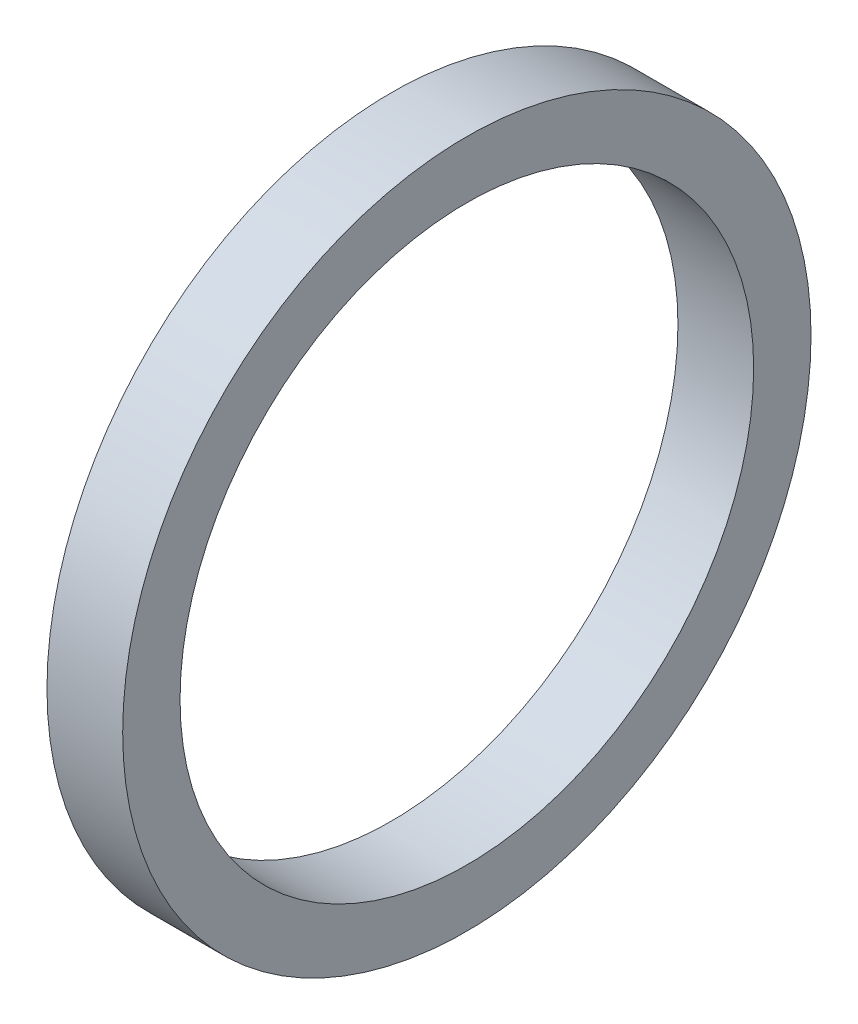
from build123d import *

# Parameters (mm, degrees)
SKETCH1_R           = 9.525
SKETCH1_R_2         = 7.9375
BOSS_EXTRUDE1_DEPTH = 2.0955


with BuildPart() as part:
    # Sketch1 → Boss-Extrude1 (new body)
    with BuildSketch(Plane(origin=(0, 0, 0), x_dir=(0, 0, -1), z_dir=(1, 0, 0))):
        Circle(SKETCH1_R)
        Circle(SKETCH1_R_2, mode=Mode.SUBTRACT)
    extrude(amount=BOSS_EXTRUDE1_DEPTH)


solid = part.part
